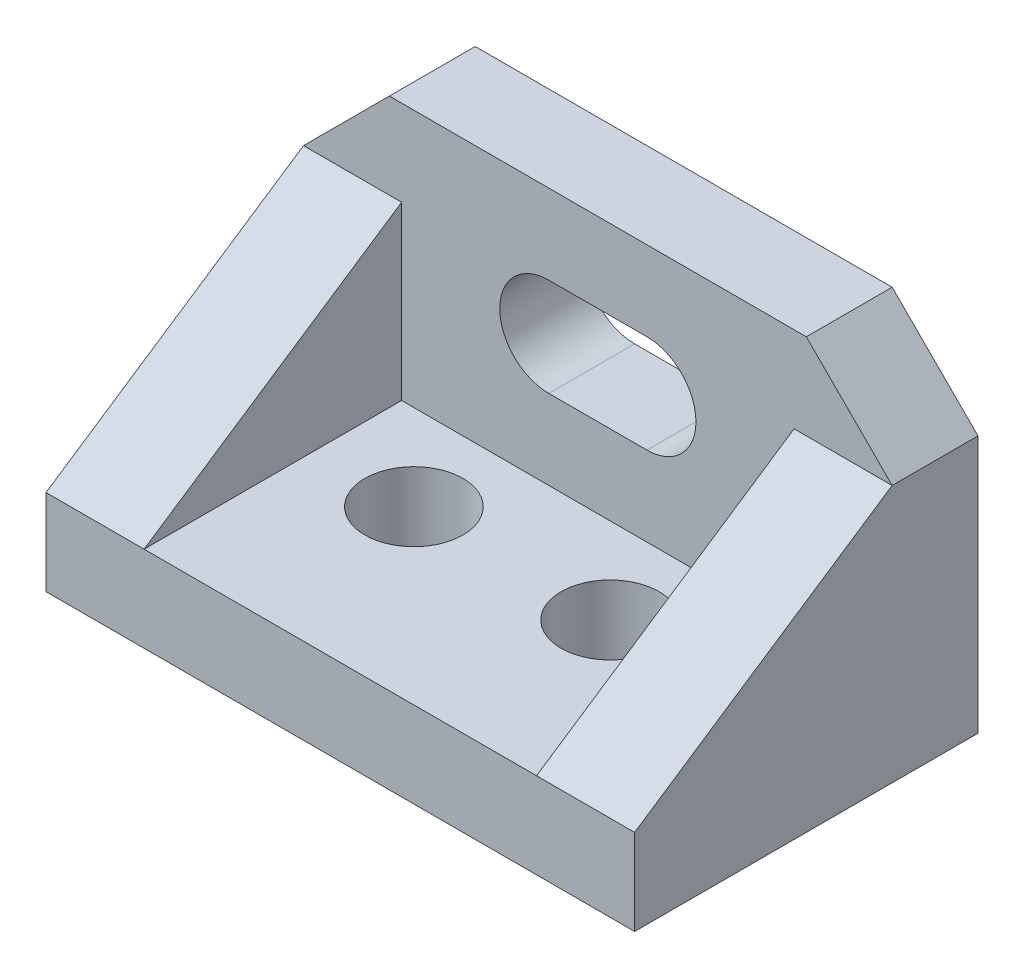
from build123d import *

# Parameters (mm, degrees)
BOSS_EXTRUDE2_DEPTH = 22.225
SKETCH4_W           = 25.4
SKETCH4_H           = 66.675
BOSS_EXTRUDE5_DEPTH = 44.45
CUT_EXTRUDE1_DEPTH  = 189.612103602
SKETCH6_W           = 152.4
SKETCH6_H           = 22.225
BOSS_EXTRUDE6_DEPTH = 66.675
CUT_EXTRUDE2_DEPTH  = 189.612103602
CUT_EXTRUDE3_DEPTH  = 189.612103602
SKETCH9_R           = 12.7
CUT_EXTRUDE4_DEPTH  = 189.612103602
CUT_EXTRUDE5_DEPTH  = 189.612103602


with BuildPart() as part:
    # Sketch1 → Boss-Extrude2 (new body)
    with BuildSketch(Plane(origin=(0, 0, 0), x_dir=(1, 0, 0), z_dir=(0, 1, 0))):
        Polygon((0, 0), (0, 88.9), (25.4, 88.9), (127, 88.9), (152.4, 88.9), (152.4, 0), align=None)
    extrude(amount=BOSS_EXTRUDE2_DEPTH)

    # Sketch4 → Boss-Extrude5 (add)
    with BuildSketch(Plane(origin=(0, 22.225, 0), x_dir=(1, 0, 0), z_dir=(0, 1, 0))):
        with Locations((12.7, 33.3375)):
            Rectangle(SKETCH4_W, SKETCH4_H)
        with Locations((139.7, 33.3375)):
            Rectangle(SKETCH4_W, SKETCH4_H)
    extrude(amount=BOSS_EXTRUDE5_DEPTH)

    # Sketch5 → Cut-Extrude1 (cut, through all)
    with BuildSketch(Plane(origin=(152.4, 0, 0), x_dir=(0, 0, -1), z_dir=(1, 0, 0))):
        Polygon((66.675, 66.675), (0, 22.225), (0, 66.675), align=None)
    extrude(amount=-CUT_EXTRUDE1_DEPTH, mode=Mode.SUBTRACT)

    # Sketch6 → Boss-Extrude6 (add)
    with BuildSketch(Plane(origin=(0, 22.225, 0), x_dir=(1, 0, 0), z_dir=(0, 1, 0))):
        with Locations((76.2, 77.7875)):
            Rectangle(SKETCH6_W, SKETCH6_H)
    extrude(amount=BOSS_EXTRUDE6_DEPTH)

    # Sketch7 → Cut-Extrude2 (cut, through all)
    with BuildSketch(Plane.XY.offset(-66.675)):
        Polygon((152.4, 66.675), (152.4, 88.9), (130.175, 88.9), align=None)
    extrude(amount=-CUT_EXTRUDE2_DEPTH, mode=Mode.SUBTRACT)

    # Sketch8 → Cut-Extrude3 (cut, through all)
    with BuildSketch(Plane.XY.offset(-66.675)):
        Polygon((0, 88.9), (22.225, 88.9), (0, 66.675), align=None)
    extrude(amount=-CUT_EXTRUDE3_DEPTH, mode=Mode.SUBTRACT)

    # Sketch9 → Cut-Extrude4 (cut, through all)
    with BuildSketch(Plane(origin=(0, 22.225, 0), x_dir=(1, 0, 0), z_dir=(0, 1, 0))):
        with Locations(Location((50.8, 44.45, 0), (0, 0, 270))):
            Circle(SKETCH9_R)
        with Locations(Location((101.6, 44.45, 0), (0, 0, 270))):
            Circle(SKETCH9_R)
    extrude(amount=-CUT_EXTRUDE4_DEPTH, mode=Mode.SUBTRACT)

    # Sketch12 → Cut-Extrude5 (cut, through all)
    with BuildSketch(Plane.XY.offset(-66.675)):
        with BuildLine():
            Line((63.5, 68.2625), (88.9, 68.2625))
            ThreePointArc((88.9, 68.2625), (101.6, 55.5625), (88.9, 42.8625))
            Line((88.9, 42.8625), (63.5, 42.8625))
            ThreePointArc((63.5, 42.8625), (50.8, 55.5625), (63.5, 68.2625))
        make_face()
    extrude(amount=-CUT_EXTRUDE5_DEPTH, mode=Mode.SUBTRACT)


solid = part.part
